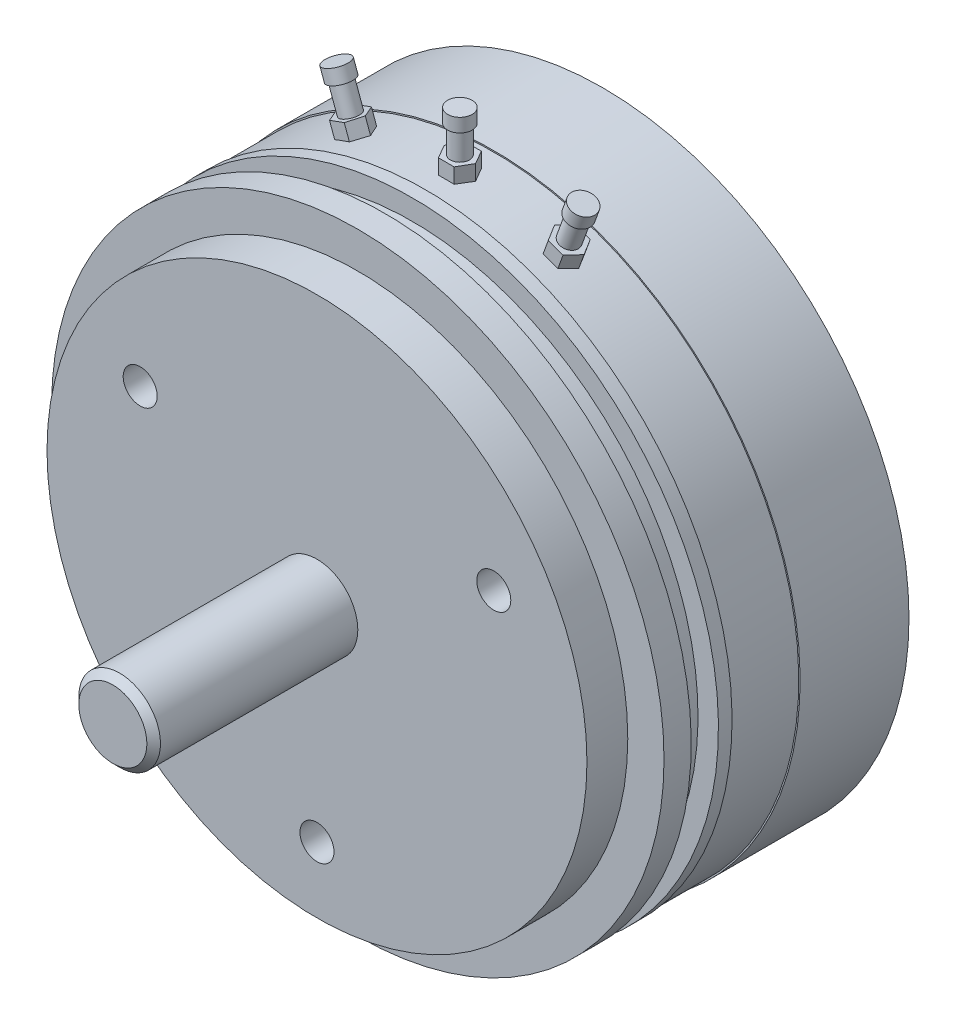
from build123d import *

# Parameters (mm, degrees)
SKETCH1_R                       = 22.5
BOSS_EXTRUDE1_DEPTH             = 18
SKETCH2_W                       = 2
SKETCH2_H                       = 1.5
SKETCH2_W_2                     = 5
SKETCH2_H_2                     = 0.1
SKETCH3_R                       = 19.8375
BOSS_EXTRUDE2_DEPTH             = 3
SKETCH4_R                       = 3
BOSS_EXTRUDE3_DEPTH             = 15
BOSS_EXTRUDE4_START             = 10
SKETCH5_R                       = 3
BOSS_EXTRUDE4_DEPTH             = 10
CHAMFER1_SIZE                   = 0.5
M3X0_5_TAPPED_HOLE1_D           = 2.5
M3X0_5_TAPPED_HOLE1_DEPTH       = 4
BOSS_EXTRUDE5_DEPTH             = 23.5
SKETCH11_R                      = 0.7
BOSS_EXTRUDE6_DEPTH             = 2
SKETCH12_R                      = 0.9
BOSS_EXTRUDE7_DEPTH             = 1
CIRPATTERN1_COUNT               = 2
CIRPATTERN1_ANGLE               = 20
CIRPATTERN1_THE_OTHER_WAY_COUNT = 2
CIRPATTERN1_THE_OTHER_WAY_ANGLE = 20


with BuildPart() as part:
    # Sketch1 → Boss-Extrude1 (new body)
    with BuildSketch(Plane.XY):
        Circle(SKETCH1_R)
    extrude(amount=BOSS_EXTRUDE1_DEPTH)

    # Sketch2 → Cut-Revolve1 (revolve, cut)
    with BuildSketch(Plane(origin=(0, 0, 0), x_dir=(0, 0, -1), z_dir=(1, 0, 0)), mode=Mode.PRIVATE) as cut_revolve1_sk:
        with Locations((-15, 21.75)):
            Rectangle(SKETCH2_W, SKETCH2_H)
        with Locations((-10.5, 22.45)):
            Rectangle(SKETCH2_W_2, SKETCH2_H_2)
    revolve(cut_revolve1_sk.sketch.rotate(Axis((0, 0, 18), (0, 0, -1)), 180), axis=Axis((0, 0, 18), (0, 0, -1)), mode=Mode.SUBTRACT)

    # Sketch3 → Boss-Extrude2 (add)
    with BuildSketch(Plane.XY.offset(18)):
        Circle(SKETCH3_R)
    extrude(amount=BOSS_EXTRUDE2_DEPTH)

    # Sketch4 → Boss-Extrude3 (add)
    with BuildSketch(Plane.XY.offset(21)):
        Circle(SKETCH4_R)
    extrude(amount=BOSS_EXTRUDE3_DEPTH)

    # Sketch5 → Boss-Extrude4 (add)
    with BuildSketch(Plane(origin=(0, 0, 0), x_dir=(-1, 0, 0), z_dir=(0, 0, -1)).offset(BOSS_EXTRUDE4_START)):
        with Locations(Location((0, 0, 0), (0, 0, 180))):
            Circle(SKETCH5_R)
    extrude(amount=-BOSS_EXTRUDE4_DEPTH)

    # Chamfer1
    chamfer1_edges = [part.edges().sort_by_distance(p)[0] for p in [
        (-3, 0, 36),
        (-3, 0, -10),
    ]]
    chamfer(chamfer1_edges, length=CHAMFER1_SIZE)

    # M3x0.5 Tapped Hole1
    with Locations(Plane.XY.offset(21)):
        with Locations((12.990381057, 7.5), (0, -15), (-12.990381057, 7.5)):
            Hole(M3X0_5_TAPPED_HOLE1_D / 2, depth=M3X0_5_TAPPED_HOLE1_DEPTH)

    # Sketch10 → Boss-Extrude5 (add)
    with BuildSketch(Plane(origin=(0, 0, 0), x_dir=(1, 0, 0), z_dir=(0, 1, 0))):
        Polygon((1.154700538, -10.5), (0.577350269, -9.5), (-0.577350269, -9.5), (-1.154700538, -10.5), (-0.577350269, -11.5), (0.577350269, -11.5), align=None)
    boss_extrude5 = extrude(amount=BOSS_EXTRUDE5_DEPTH)

    # Sketch11 → Boss-Extrude6 (add)
    with BuildSketch(Plane(origin=(0, 23.5, 0), x_dir=(1, 0, 0), z_dir=(0, 1, 0))):
        with Locations(Location((0, -10.5, 0), (0, 0, 270))):
            Circle(SKETCH11_R)
    boss_extrude6 = extrude(amount=BOSS_EXTRUDE6_DEPTH)

    # Sketch12 → Boss-Extrude7 (add)
    with BuildSketch(Plane(origin=(0, 25.5, 0), x_dir=(1, 0, 0), z_dir=(0, 1, 0))):
        with Locations(Location((0, -10.5, 0), (0, 0, 270))):
            Circle(SKETCH12_R)
    boss_extrude7 = extrude(amount=BOSS_EXTRUDE7_DEPTH)

    # CirPattern1: Boss-Extrude5, Boss-Extrude6, Boss-Extrude7 ×2 about axis
    cirpattern1_axis = Axis((0, 0, 0), (0, 0, 1))
    add([boss_extrude5.rotate(cirpattern1_axis, i * CIRPATTERN1_ANGLE / (CIRPATTERN1_COUNT - 1)) for i in range(1, CIRPATTERN1_COUNT)])
    add([boss_extrude6.rotate(cirpattern1_axis, i * CIRPATTERN1_ANGLE / (CIRPATTERN1_COUNT - 1)) for i in range(1, CIRPATTERN1_COUNT)])
    add([boss_extrude7.rotate(cirpattern1_axis, i * CIRPATTERN1_ANGLE / (CIRPATTERN1_COUNT - 1)) for i in range(1, CIRPATTERN1_COUNT)])

    # CirPattern1 the other way: Boss-Extrude5, Boss-Extrude6, Boss-Extrude7 ×2 about axis
    cirpattern1_the_other_way_axis = Axis((0, 0, 0), (0, 0, -1))
    add([boss_extrude5.rotate(cirpattern1_the_other_way_axis, i * CIRPATTERN1_THE_OTHER_WAY_ANGLE / (CIRPATTERN1_THE_OTHER_WAY_COUNT - 1)) for i in range(1, CIRPATTERN1_THE_OTHER_WAY_COUNT)])
    add([boss_extrude6.rotate(cirpattern1_the_other_way_axis, i * CIRPATTERN1_THE_OTHER_WAY_ANGLE / (CIRPATTERN1_THE_OTHER_WAY_COUNT - 1)) for i in range(1, CIRPATTERN1_THE_OTHER_WAY_COUNT)])
    add([boss_extrude7.rotate(cirpattern1_the_other_way_axis, i * CIRPATTERN1_THE_OTHER_WAY_ANGLE / (CIRPATTERN1_THE_OTHER_WAY_COUNT - 1)) for i in range(1, CIRPATTERN1_THE_OTHER_WAY_COUNT)])


solid = part.part
